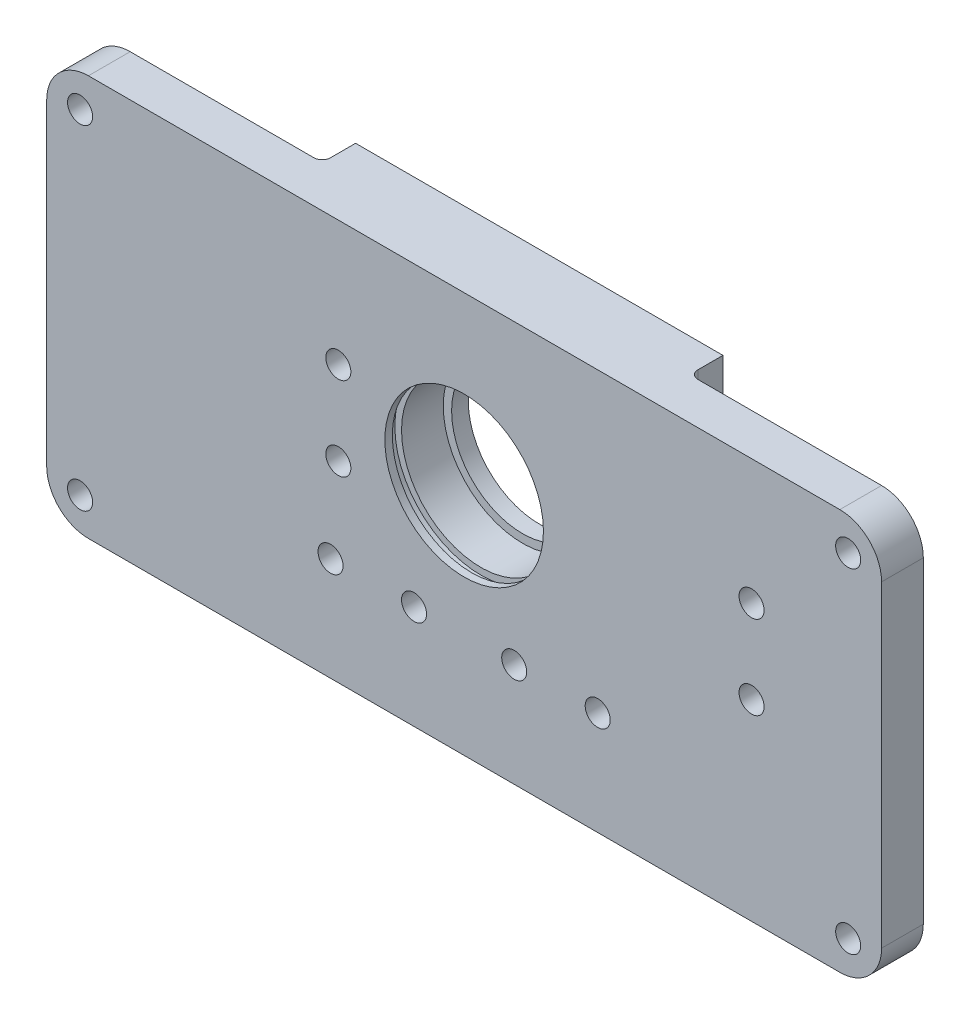
from build123d import *

# Parameters (mm, degrees)
SKETCH_1_W                = 100
SKETCH_1_H                = 40
EXTRUDE_1_DEPTH           = 6
SKETCH_2_W                = 100
SKETCH_2_H                = 40
EXTRUDE_2_DEPTH           = 3
SKETCH_4_R                = 9.5
CUT_EXTRUDE_1_DEPTH       = 7
SKETCH_5_R                = 10.3
CUT_EXTRUDE_2_DEPTH       = 1.1
CUT_EXTRUDE_START         = -5
SKETCH_6_R                = 9.5
CUT_EXTRUDE_3_DEPTH       = 5
SKETCH_7_R                = 1.5
CUT_EXTRUDE_4_DEPTH       = 12
SKETCH_8_W                = 100
SKETCH_8_H                = 9
EXTRUDE_3_DEPTH           = 8
SKETCH_9_R                = 1.5
CUT_EXTRUDE_5_DEPTH       = 10
SKETCH_13_R               = 1.5
CUT_EXTRUDE_6_DEPTH       = 10
HOLE_WIZARD_1_D           = 3
HOLE_WIZARD_1_CBORE_D     = 5.5
HOLE_WIZARD_1_CBORE_DEPTH = 3
SKETCH_15_W               = 28
SKETCH_15_H               = 56.444719302
SKETCH_15_H_2             = 58.874458875
CUT_EXTRUDE_7_DEPTH       = 4
FILLET_3_R                = 1
FILLET_4_R                = 5
SKETCH_16_R               = 9.5
SKETCH_16_R_2             = 8.5
EXTRUDE_4_DEPTH           = 2


with BuildPart() as part:
    # 草图1 → 凸台-拉伸1 (new body)
    with BuildSketch(Plane.XY):
        Rectangle(SKETCH_1_W, SKETCH_1_H)
    extrude(amount=EXTRUDE_1_DEPTH)

    # 草图2 → 凸台-拉伸2 (add)
    with BuildSketch(Plane(origin=(0, 0, 0), x_dir=(-1, 0, 0), z_dir=(0, 0, -1))):
        Rectangle(SKETCH_2_W, SKETCH_2_H)
    extrude(amount=EXTRUDE_2_DEPTH)

    # 草图4 → 切除-拉伸1 (cut)
    with BuildSketch(Plane(origin=(0, 0, -3), x_dir=(-1, 0, 0), z_dir=(0, 0, -1))):
        Circle(SKETCH_4_R)
    extrude(amount=-CUT_EXTRUDE_1_DEPTH, mode=Mode.SUBTRACT)

    # 草图5 → 切除-拉伸2 (cut)
    with BuildSketch(Plane(origin=(0, 0, 4), x_dir=(-1, 0, 0), z_dir=(0, 0, -1))):
        Circle(SKETCH_5_R)
    extrude(amount=-CUT_EXTRUDE_2_DEPTH, mode=Mode.SUBTRACT)

    # 草图6 → 切除-拉伸3 (cut)
    with BuildSketch(Plane.XY.offset(6).offset(CUT_EXTRUDE_START)):
        with Locations(Location((0, 0, 0), (0, 0, 180))):
            Circle(SKETCH_6_R)
    extrude(amount=CUT_EXTRUDE_3_DEPTH, mode=Mode.SUBTRACT)

    # 草图7 → 切除-拉伸4 (cut)
    with BuildSketch(Plane.XY.offset(6)):
        with Locations((-15.07, 5)):
            Circle(SKETCH_7_R)
        with Locations((34.43, 5)):
            Circle(SKETCH_7_R)
        with Locations((-15.07, -5)):
            Circle(SKETCH_7_R)
        with Locations((34.43, -5)):
            Circle(SKETCH_7_R)
    extrude(amount=-CUT_EXTRUDE_4_DEPTH, mode=Mode.SUBTRACT)

    # 草图8 → 凸台-拉伸3 (add)
    with BuildSketch(Plane.XZ.offset(20)):
        with Locations((0, 1.5)):
            Rectangle(SKETCH_8_W, SKETCH_8_H)
    extrude(amount=EXTRUDE_3_DEPTH)

    # 草图9 → 切除-拉伸5 (cut)
    with BuildSketch(Plane(origin=(0, 0, -3), x_dir=(-1, 0, 0), z_dir=(0, 0, -1))):
        with Locations((-6, -15.6)):
            Circle(SKETCH_9_R)
        with Locations((6, -15.6)):
            Circle(SKETCH_9_R)
        with Locations((-16, -15.6)):
            Circle(SKETCH_9_R)
        with Locations((16, -15.6)):
            Circle(SKETCH_9_R)
    extrude(amount=-CUT_EXTRUDE_5_DEPTH, mode=Mode.SUBTRACT)

    # 草图13 → 切除-拉伸6 (cut)
    with BuildSketch(Plane.XY.offset(6)):
        with Locations((-46, 16)):
            Circle(SKETCH_13_R)
        with Locations((46, 16)):
            Circle(SKETCH_13_R)
        with Locations((-46, -24)):
            Circle(SKETCH_13_R)
        with Locations((46, -24)):
            Circle(SKETCH_13_R)
    extrude(amount=-CUT_EXTRUDE_6_DEPTH, mode=Mode.SUBTRACT)

    # 孔1 (through all)
    with Locations(Plane(origin=(-16, -15.6, -3), x_dir=(-1, 0, 0), z_dir=(0, 0, -1))):
        with Locations((0, 0), (-10, 0), (-22, 0), (-32, 0)):
            CounterBoreHole(HOLE_WIZARD_1_D / 2, HOLE_WIZARD_1_CBORE_D / 2, HOLE_WIZARD_1_CBORE_DEPTH)

    # 草图15 → 切除-拉伸7 (cut)
    with BuildSketch(Plane(origin=(0, 0, -3), x_dir=(-1, 0, 0), z_dir=(0, 0, -1))):
        with Locations((-36, -3.626193912)):
            Rectangle(SKETCH_15_W, SKETCH_15_H)
        with Locations((36, -5.588675874)):
            Rectangle(SKETCH_15_W, SKETCH_15_H_2)
    extrude(amount=-CUT_EXTRUDE_7_DEPTH, mode=Mode.SUBTRACT)

    # 圆角3
    fillet_3_edges = [part.edges().sort_by_distance(p)[0] for p in [
        (22, -4, 1),
        (-22, -4, 1),
    ]]
    fillet(fillet_3_edges, radius=FILLET_3_R)

    # 圆角4
    fillet_4_edges = [part.edges().sort_by_distance(p)[0] for p in [
        (50, -28, 3.5),
        (-50, -28, 3.5),
        (-50, 20, 3.5),
        (50, 20, 3.5),
    ]]
    fillet(fillet_4_edges, radius=FILLET_4_R)

    # 草图16 → 凸台-拉伸4 (add)
    with BuildSketch(Plane(origin=(0, 0, -3), x_dir=(-1, 0, 0), z_dir=(0, 0, -1))):
        Circle(SKETCH_16_R)
        Circle(SKETCH_16_R_2, mode=Mode.SUBTRACT)
    extrude(amount=-EXTRUDE_4_DEPTH)


solid = part.part
